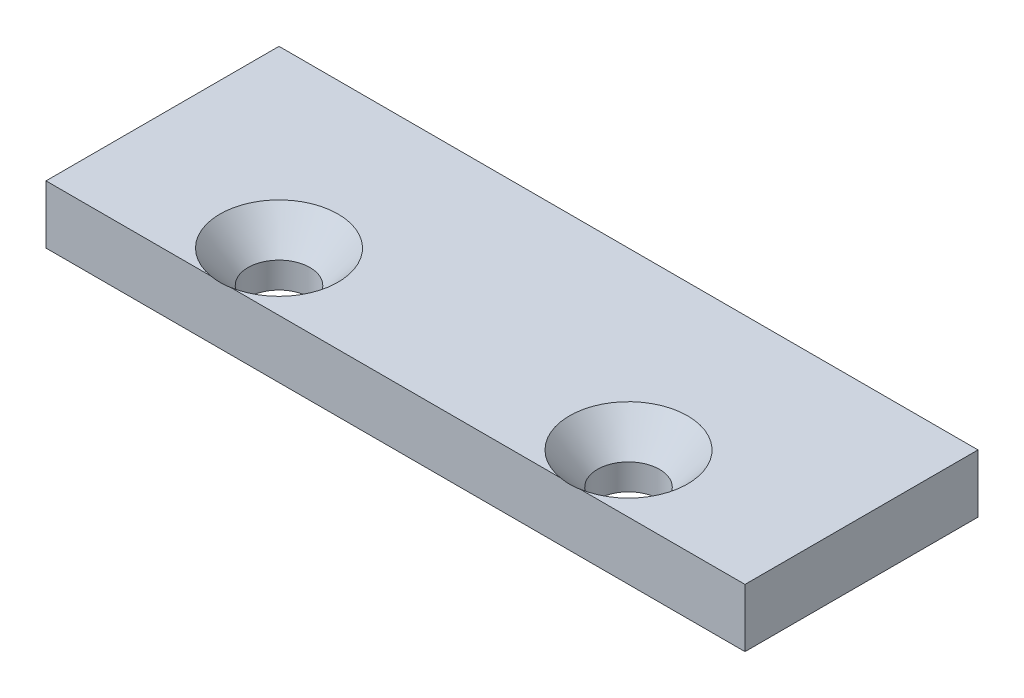
from build123d import *

# Parameters (mm, degrees)
SKETCH1_W                                     = 76.2
SKETCH1_H                                     = 25.4
BOSS_EXTRUDE1_DEPTH                           = 6.35
CSK_FOR_1_4_FLAT_HEAD_MACHINE_SCREW1_AT_COUNT = 2
CSK_FOR_1_4_FLAT_HEAD_MACHINE_SCREW1_AT_PITCH = 38.1


with BuildPart() as part:
    # Sketch1 → Boss-Extrude1 (new body)
    with BuildSketch(Plane(origin=(0, 0, 0), x_dir=(1, 0, 0), z_dir=(0, 1, 0))):
        with Locations((38.1, 12.7)):
            Rectangle(SKETCH1_W, SKETCH1_H)
    extrude(amount=-BOSS_EXTRUDE1_DEPTH)

    # Sketch3 → CSK for 1/4 Flat Head Machine Screw1 (revolve, cut)
    with BuildSketch(Plane(origin=(19.05, 0, -6.35), x_dir=(0, 0, 1), z_dir=(1, 0, 0))):
        Polygon((0, 0), (0, 6.35), (3.3782, 6.35), (3.3782, 3.520932584), (6.4389, 0), align=None)
    csk_for_1_4_flat_head_machine_screw1 = revolve(axis=Axis((19.05, 6.35, -6.35), (0, -1, 0)), mode=Mode.SUBTRACT)

    # CSK for 1/4 Flat Head Machine Screw1 at: CSK for 1/4 Flat Head Machine Screw1 ×2
    with Locations(*[(i * CSK_FOR_1_4_FLAT_HEAD_MACHINE_SCREW1_AT_PITCH, 0, 0) for i in range(1, CSK_FOR_1_4_FLAT_HEAD_MACHINE_SCREW1_AT_COUNT)]):
        add(csk_for_1_4_flat_head_machine_screw1, mode=Mode.SUBTRACT)


solid = part.part
